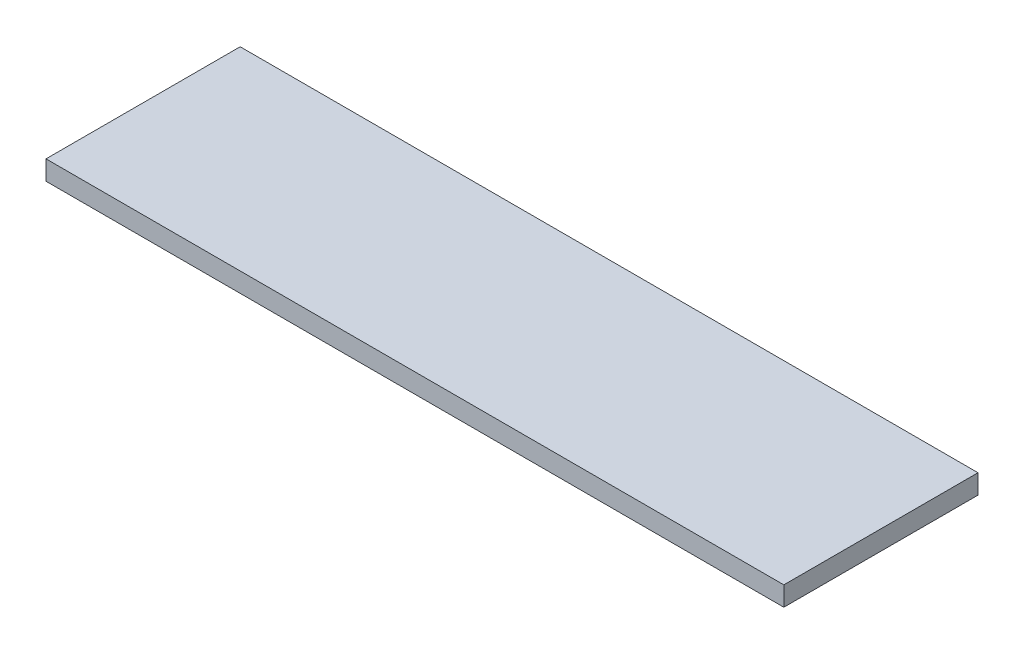
from build123d import *

# Parameters (mm, degrees)
SKETCH1_W           = 120.65
SKETCH1_H           = 31.75
BOSS_EXTRUDE1_DEPTH = 3.175


with BuildPart() as part:
    # Sketch1 → Boss-Extrude1 (new body)
    with BuildSketch(Plane(origin=(0, 0, 0), x_dir=(1, 0, 0), z_dir=(0, 1, 0))):
        with Locations((60.325, 15.875)):
            Rectangle(SKETCH1_W, SKETCH1_H)
    extrude(amount=BOSS_EXTRUDE1_DEPTH)


solid = part.part
